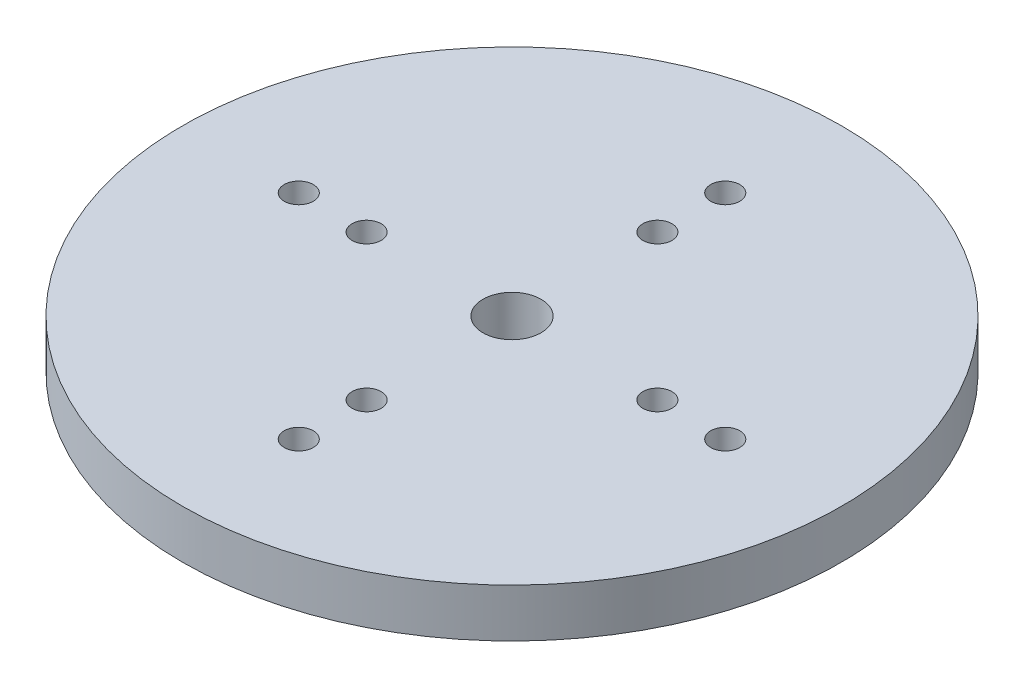
from build123d import *

# Parameters (mm, degrees)
SKETCH2_R                    = 34
BOSS_EXTRUDE1_DEPTH          = 5
SKETCH3_R                    = 1.5
CUT_EXTRUDE1_DEPTH           = 5
SKETCH5_R                    = 1.5
CUT_EXTRUDE2_DEPTH           = 5
SKETCH6_R                    = 10
BOSS_EXTRUDE2_DEPTH          = 5
SKETCH7_R                    = 2
CUT_EXTRUDE3_DEPTH           = 5
SKETCH8_R                    = 3
CUT_EXTRUDE4_DEPTH           = 10
F_3_0_3_DIAMETER_HOLE1_D     = 3
F_3_0_3_DIAMETER_HOLE1_DEPTH = 7.84
F_3_0_3_DIAMETER_HOLE1_TIP   = 0.901290929


with BuildPart() as part:
    # Sketch2 → Boss-Extrude1 (new body)
    with BuildSketch(Plane(origin=(0, 0, 0), x_dir=(1, 0, 0), z_dir=(0, 1, 0))):
        with Locations(Location((0, 0, 0), (0, 0, 270))):
            Circle(SKETCH2_R)
    extrude(amount=BOSS_EXTRUDE1_DEPTH)

    # Sketch3 → Cut-Extrude1 (cut)
    with BuildSketch(Plane.XZ):
        with Locations(Location((0, 22, 0), (0, 0, 270))):
            Circle(SKETCH3_R)
        with Locations(Location((22, 0, 0), (0, 0, 270))):
            Circle(SKETCH3_R)
        with Locations(Location((0, -22, 0), (0, 0, 270))):
            Circle(SKETCH3_R)
        with Locations(Location((-22, 0, 0), (0, 0, 270))):
            Circle(SKETCH3_R)
    extrude(amount=-CUT_EXTRUDE1_DEPTH, mode=Mode.SUBTRACT)

    # Sketch5 → Cut-Extrude2 (cut)
    with BuildSketch(Plane.XZ):
        with Locations(Location((0, 15, 0), (0, 0, 270))):
            Circle(SKETCH5_R)
        with Locations(Location((15, 0, 0), (0, 0, 270))):
            Circle(SKETCH5_R)
        with Locations(Location((0, -15, 0), (0, 0, 270))):
            Circle(SKETCH5_R)
        with Locations(Location((-15, 0, 0), (0, 0, 270))):
            Circle(SKETCH5_R)
    extrude(amount=-CUT_EXTRUDE2_DEPTH, mode=Mode.SUBTRACT)

    # Sketch6 → Boss-Extrude2 (add)
    with BuildSketch(Plane.XZ):
        with Locations(Location((0, 0, 0), (0, 0, 270))):
            Circle(SKETCH6_R)
    extrude(amount=BOSS_EXTRUDE2_DEPTH)

    # Sketch7 → Cut-Extrude3 (cut)
    with BuildSketch(Plane(origin=(0, -5, 0), x_dir=(-1, 0, 0), z_dir=(0, -1, 0))):
        with Locations(Location((5.5, -3.985, 0), (0, 0, 90))):
            Circle(SKETCH7_R)
        with Locations(Location((-5.5, -3.985, 0), (0, 0, 270))):
            Circle(SKETCH7_R)
        with Locations(Location((-5.5, 3.985, 0), (0, 0, 90))):
            Circle(SKETCH7_R)
        with Locations(Location((5.5, 3.985, 0), (0, 0, 270))):
            Circle(SKETCH7_R)
    extrude(amount=-CUT_EXTRUDE3_DEPTH, mode=Mode.SUBTRACT)

    # Sketch8 → Cut-Extrude4 (cut)
    with BuildSketch(Plane.XZ.offset(5)):
        with Locations(Location((0, 0, 0), (0, 0, 270))):
            Circle(SKETCH8_R)
    extrude(amount=-CUT_EXTRUDE4_DEPTH, mode=Mode.SUBTRACT)

    # Ø3.0 (3) Diameter Hole1
    with Locations(Plane(origin=(0.026797027, -2.5, -9.999964096), x_dir=(-0.99999640959, 0, -0.002679702708), z_dir=(0.002679702708, 0, -0.99999640959))):
        with Locations((0, 0)):
            Hole(F_3_0_3_DIAMETER_HOLE1_D / 2, depth=F_3_0_3_DIAMETER_HOLE1_DEPTH)
            with Locations((0, 0, -(F_3_0_3_DIAMETER_HOLE1_DEPTH + F_3_0_3_DIAMETER_HOLE1_TIP / 2))):  # 118° drill point
                Cone(0, F_3_0_3_DIAMETER_HOLE1_D / 2, F_3_0_3_DIAMETER_HOLE1_TIP, mode=Mode.SUBTRACT)


solid = part.part
